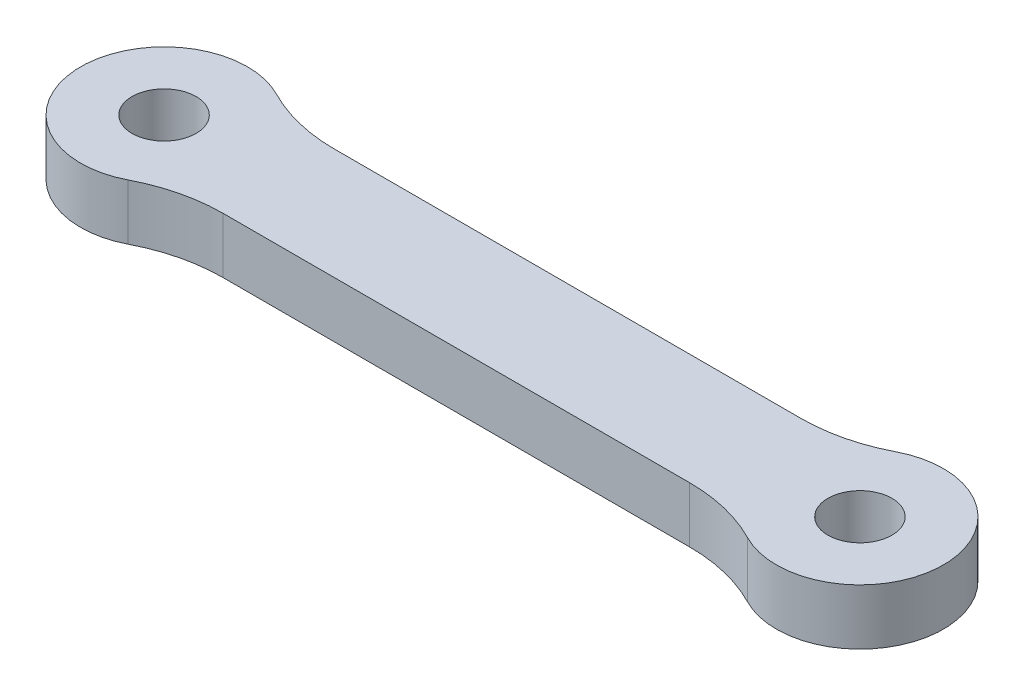
from build123d import *

# Parameters (mm, degrees)
SKETCH_1_R      = 1.15
EXTRUDE_1_DEPTH = 2
FILLET_1_R      = 6


with BuildPart() as part:
    # Эскиз1 → Бобышка-Вытянуть1 (new body)
    with BuildSketch(Plane(origin=(0, 0, 0), x_dir=(1, 0, 0), z_dir=(0, 1, 0))):
        with BuildLine():
            Line((2.236067977, 2), (22.763932023, 2))
            ThreePointArc((22.763932023, 2), (28, 0), (22.763932023, -2))
            Line((22.763932023, -2), (2.236067977, -2))
            ThreePointArc((2.236067977, -2), (-3, 0), (2.236067977, 2))
        make_face()
        with Locations(Location((0, 0, 0), (0, 0, 270))):
            Circle(SKETCH_1_R, mode=Mode.SUBTRACT)
        with Locations(Location((25, 0, 0), (0, 0, 270))):
            Circle(SKETCH_1_R, mode=Mode.SUBTRACT)
    extrude(amount=EXTRUDE_1_DEPTH)

    # Скругление1
    fillet_1_edges = [part.edges().sort_by_distance(p)[0] for p in [
        (2.236067977, 1, 2),
        (2.236067977, 1, -2),
        (22.763932023, 1, -2),
        (22.763932023, 1, 2),
    ]]
    fillet(fillet_1_edges, radius=FILLET_1_R)


solid = part.part
